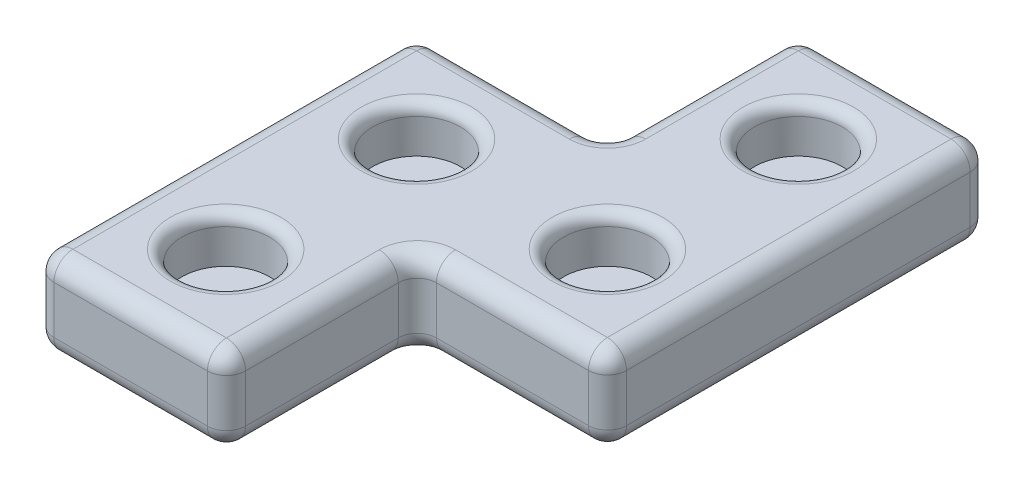
from build123d import *

# Parameters (mm, degrees)
BOSS_EXTRUDE1_DEPTH = 5.715
SKETCH2_R           = 2.921
CUT_EXTRUDE1_DEPTH  = 3.048
FILLET1_R           = 1.27
FILLET2_R           = 1.27
FILLET3_R           = 0.762


with BuildPart() as part:
    # Sketch1 → Boss-Extrude1 (new body)
    with BuildSketch(Plane(origin=(0, 0, 0), x_dir=(1, 0, 0), z_dir=(0, 1, 0))):
        with BuildLine():
            Line((-7.665886605, 2.665075851), (-7.665886605, 12.825075851))
            ThreePointArc((-7.665886605, 12.825075851), (-7.293912217, 13.723101463), (-6.395886605, 14.095075851))
            Line((-6.395886605, 14.095075851), (3.764113395, 14.095075851))
            ThreePointArc((3.764113395, 14.095075851), (4.662139007, 13.723101463), (5.034113395, 12.825075851))
            Line((5.034113395, 12.825075851), (5.034113395, -10.034924149))
            ThreePointArc((5.034113395, -10.034924149), (4.662139007, -10.932949761), (3.764113395, -11.304924149))
            Line((3.764113395, -11.304924149), (-6.340896914, -11.304924149))
            ThreePointArc((-6.340896914, -11.304924149), (-7.238922526, -11.676898537), (-7.610896914, -12.574924149))
            Line((-7.610896914, -12.574924149), (-7.610896914, -22.734924149))
            ThreePointArc((-7.610896914, -22.734924149), (-7.982871302, -23.632949761), (-8.880896914, -24.004924149))
            Line((-8.880896914, -24.004924149), (-19.095886605, -24.004924149))
            ThreePointArc((-19.095886605, -24.004924149), (-19.993912217, -23.632949761), (-20.365886605, -22.734924149))
            Line((-20.365886605, -22.734924149), (-20.365886605, 0.125075851))
            ThreePointArc((-20.365886605, 0.125075851), (-19.993912217, 1.023101463), (-19.095886605, 1.395075851))
            Line((-19.095886605, 1.395075851), (-8.935886605, 1.395075851))
            ThreePointArc((-8.935886605, 1.395075851), (-8.037860993, 1.767050239), (-7.665886605, 2.665075851))
        make_face()
    extrude(amount=BOSS_EXTRUDE1_DEPTH)

    # Sketch2 → Cut-Extrude1 (cut)
    with BuildSketch(Plane(origin=(0, 5.715, 0), x_dir=(1, 0, 0), z_dir=(0, 1, 0))):
        with Locations(Location((-1.315886605, 7.745075851, 0), (0, 0, 270))):
            Circle(SKETCH2_R)
        with Locations(Location((-14.015886605, -4.954924149, 0), (0, 0, 270))):
            Circle(SKETCH2_R)
        with Locations(Location((-14.015886605, -17.654924149, 0), (0, 0, 270))):
            Circle(SKETCH2_R)
        with Locations(Location((-1.315886605, -4.954924149, 0), (0, 0, 270))):
            Circle(SKETCH2_R)
    extrude(amount=-CUT_EXTRUDE1_DEPTH, mode=Mode.SUBTRACT)

    # Fillet1
    fillet1_edges = [part.edges().sort_by_distance(p)[0] for p in [
        (-19.993912217, 5.715, -1.023101463),
        (-20.365886605, 5.715, 11.304924149),
        (-19.993912217, 5.715, 23.632949761),
        (-13.988391759, 5.715, 24.004924149),
        (-7.982871302, 5.715, 23.632949761),
        (-7.610896914, 5.715, 17.654924149),
        (-7.238922526, 5.715, 11.676898537),
        (-1.288391759, 5.715, 11.304924149),
        (4.662139007, 5.715, 10.932949761),
        (5.034113395, 5.715, -1.395075851),
        (-8.037860993, 5.715, -1.767050239),
        (4.662139007, 5.715, -13.723101463),
        (-1.315886605, 5.715, -14.095075851),
        (-7.293912217, 5.715, -13.723101463),
        (-7.665886605, 5.715, -7.745075851),
        (-14.015886605, 5.715, -1.395075851),
    ]]
    fillet(fillet1_edges, radius=FILLET1_R)

    # Fillet2
    fillet2_edges = [part.edges().sort_by_distance(p)[0] for p in [
        (-7.665886605, 0, -7.745075851),
        (-7.293912217, 0, -13.723101463),
        (-1.315886605, 0, -14.095075851),
        (4.662139007, 0, -13.723101463),
        (5.034113395, 0, -1.395075851),
        (4.662139007, 0, 10.932949761),
        (-1.288391759, 0, 11.304924149),
        (-7.238922526, 0, 11.676898537),
        (-7.610896914, 0, 17.654924149),
        (-7.982871302, 0, 23.632949761),
        (-13.988391759, 0, 24.004924149),
        (-19.993912217, 0, 23.632949761),
        (-20.365886605, 0, 11.304924149),
        (-19.993912217, 0, -1.023101463),
        (-14.015886605, 0, -1.395075851),
        (-8.037860993, 0, -1.767050239),
    ]]
    fillet(fillet2_edges, radius=FILLET2_R)

    # Fillet3
    fillet3_edges = [part.edges().sort_by_distance(p)[0] for p in [
        (-1.315886605, 5.715, -10.666075851),
        (-14.015886605, 5.715, 2.033924149),
        (-14.015886605, 5.715, 14.733924149),
        (-1.315886605, 5.715, 2.033924149),
    ]]
    fillet(fillet3_edges, radius=FILLET3_R)


solid = part.part
